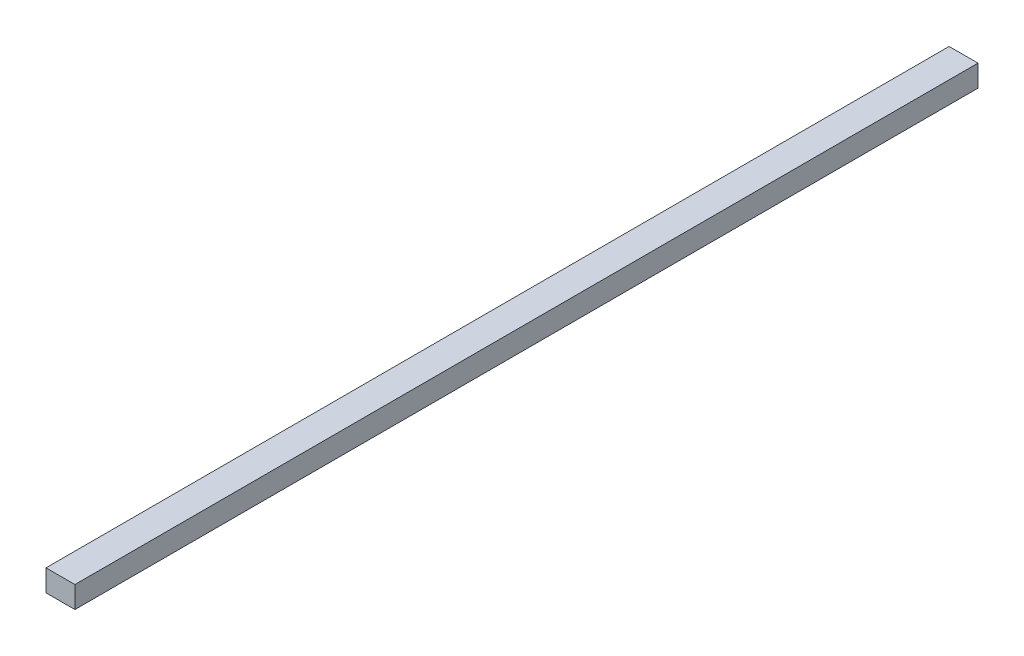
from build123d import *

# Parameters (mm, degrees)
PRESS_UC_CATAL_LAMA_1_1_START = -50
SKETCH1_W                     = 16
SKETCH1_H                     = 12
PRESS_UC_CATAL_LAMA_1_1_DEPTH = 500


with BuildPart() as part:
    # Sketch1 → PRESS_uc_catal_lama_1_1 (new body)
    with BuildSketch(Plane.XY.offset(PRESS_UC_CATAL_LAMA_1_1_START)):
        with Locations((298, 1182)):
            Rectangle(SKETCH1_W, SKETCH1_H)
    extrude(amount=-PRESS_UC_CATAL_LAMA_1_1_DEPTH)


solid = part.part
